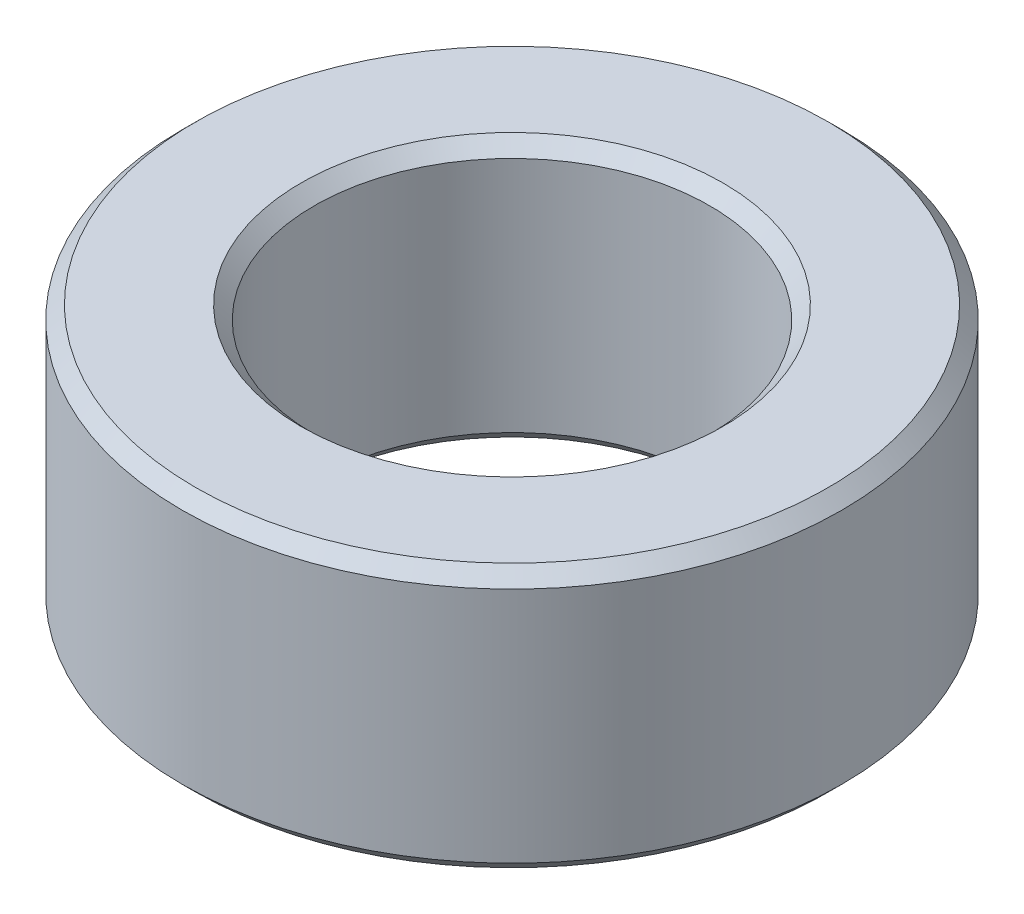
from build123d import *

# Parameters (mm, degrees)
SKETCH_1_R      = 5
SKETCH_1_R_2    = 3
EXTRUDE_1_DEPTH = 4
CHAMFER_1_SIZE  = 0.2


with BuildPart() as part:
    # 草图1 → 凸台-拉伸1 (new body)
    with BuildSketch(Plane(origin=(0, 0, 0), x_dir=(1, 0, 0), z_dir=(0, 1, 0))):
        with Locations(Location((0, 0, 0), (0, 0, 270))):
            Circle(SKETCH_1_R)
        with Locations(Location((0, 0, 0), (0, 0, 270))):
            Circle(SKETCH_1_R_2, mode=Mode.SUBTRACT)
    extrude(amount=EXTRUDE_1_DEPTH)

    # 倒角1
    chamfer_1_edges = [part.edges().sort_by_distance(p)[0] for p in [
        (0, 4, -5),
        (0, 0, -5),
        (0, 0, -3),
        (0, 4, -3),
    ]]
    chamfer(chamfer_1_edges, length=CHAMFER_1_SIZE)


solid = part.part
